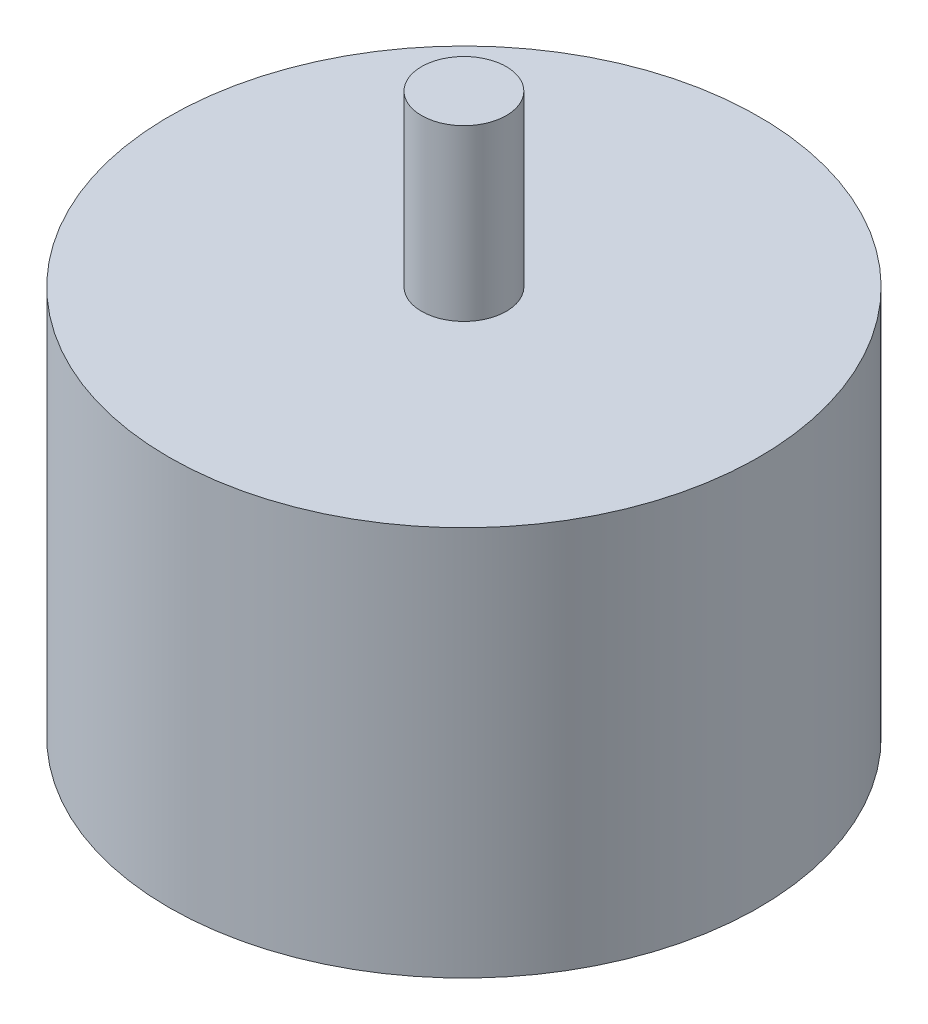
from build123d import *

# Parameters (mm, degrees)
SKETCH1_R           = 17.399
BOSS_EXTRUDE1_DEPTH = 23.0000048
SKETCH2_R           = 2.5
BOSS_EXTRUDE2_DEPTH = 10
SKETCH3_R           = 1.499997
BOSS_EXTRUDE3_DEPTH = 2
SKETCH4_R           = 1.524
SKETCH4_R_2         = 1.5
CUT_EXTRUDE1_DEPTH  = 2


with BuildPart() as part:
    # Sketch1 → Boss-Extrude1 (new body)
    with BuildSketch(Plane(origin=(0, 0, 0), x_dir=(1, 0, 0), z_dir=(0, 1, 0))):
        with Locations(Location((0, 0, 0), (0, 0, 270))):
            Circle(SKETCH1_R)
    extrude(amount=BOSS_EXTRUDE1_DEPTH)

    # Sketch2 → Boss-Extrude2 (add)
    with BuildSketch(Plane(origin=(0, 23.0000048, 0), x_dir=(1, 0, 0), z_dir=(0, 1, 0))):
        with Locations(Location((0, 0, 0), (0, 0, 270))):
            Circle(SKETCH2_R)
    extrude(amount=BOSS_EXTRUDE2_DEPTH)

    # Sketch3 → Boss-Extrude3 (add)
    with BuildSketch(Plane.XZ):
        with Locations(Location((0, 0, 0), (0, 0, 90))):
            Circle(SKETCH3_R)
    extrude(amount=BOSS_EXTRUDE3_DEPTH)

    # Sketch4 → Cut-Extrude1 (cut)
    with BuildSketch(Plane.XZ):
        with Locations(Location((0, 12.5000004, 0), (0, 0, 270))):
            Circle(SKETCH4_R)
        with Locations(Location((9.4999937, 0, 0), (0, 0, 270))):
            Circle(SKETCH4_R_2)
        with Locations(Location((-9.4999937, 0, 0), (0, 0, 90))):
            Circle(SKETCH4_R_2)
        with Locations(Location((0, -12.5000004, 0), (0, 0, 90))):
            Circle(SKETCH4_R)
    extrude(amount=-CUT_EXTRUDE1_DEPTH, mode=Mode.SUBTRACT)


solid = part.part
